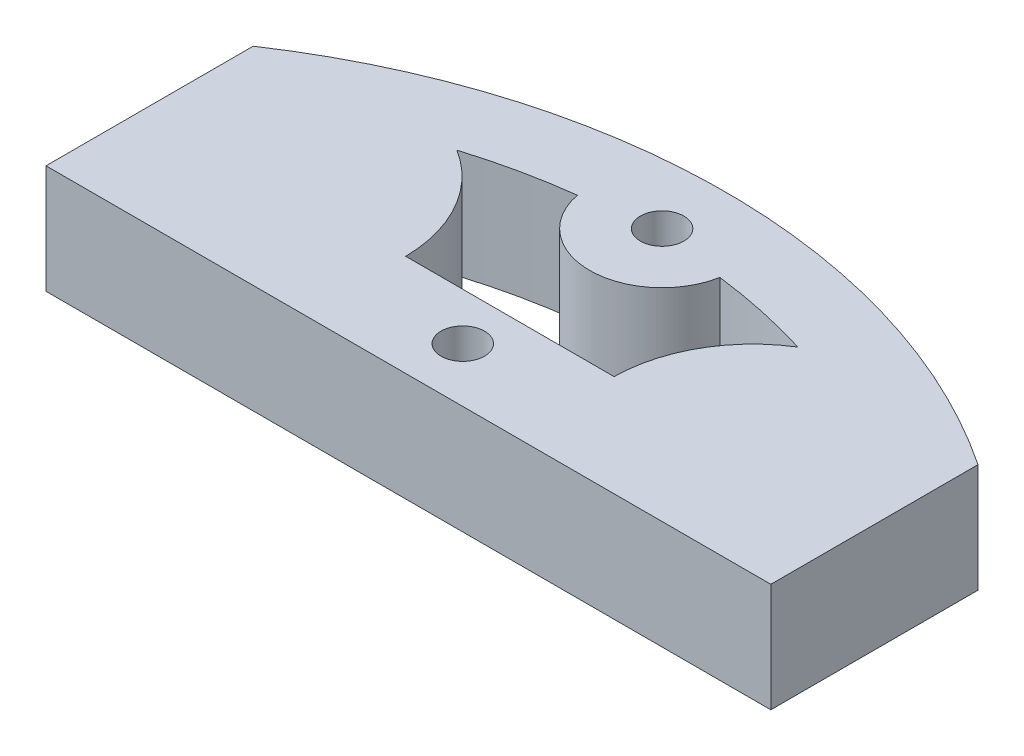
from build123d import *

# Parameters (mm, degrees)
BOSS_EXTRUDE1_DEPTH  = 6
CUT_EXTRUDE15_DEPTH  = 103.528044944
SKETCH19_OUTSIDE_W   = 185.536
SKETCH19_OUTSIDE_H   = 176.439
SKETCH19_OUTSIDE_W_2 = 80
SKETCH19_OUTSIDE_H_2 = 40
CUT_EXTRUDE16_DEPTH  = 103.528044944
SKETCH20_R           = 2.4
CUT_EXTRUDE17_DEPTH  = 84.234608187


with BuildPart() as part:
    # Sketch1 → Boss-Extrude1 (new, symmetric)
    with BuildSketch(Plane(origin=(0, 0, 0), x_dir=(1, 0, 0), z_dir=(0, 1, 0))):
        with BuildLine():
            ThreePointArc((36.224522061, -62.223661106), (0, 72), (-36.224522061, -62.223661106))
            ThreePointArc((-36.224522061, -62.223661106), (-32.797800029, -62.818856853), (-29.811944095, -61.035223988))
            ThreePointArc((-29.811944095, -61.035223988), (0, -46.75), (29.811944095, -61.035223988))
            ThreePointArc((29.811944095, -61.035223988), (32.797800029, -62.818856853), (36.224522061, -62.223661106))
        make_face()
    extrude(amount=BOSS_EXTRUDE1_DEPTH, both=True)

    # Sketch17 → Cut-Extrude15 (cut, through all)
    with BuildSketch(Plane(origin=(0, 6, 0), x_dir=(1, 0, 0), z_dir=(0, 1, 0))):
        with BuildLine():
            Line((11.501290376, 48.2), (-11.501290376, 48.2))
            ThreePointArc((-11.501290376, 48.2), (-13.503335986, 55.621683574), (-18.824890953, 61.168811339))
            ThreePointArc((-18.824890953, 61.168811339), (-13.394450398, 62.582654933), (-7.861037919, 63.515384615))
            ThreePointArc((-7.861037919, 63.515384615), (0, 57), (7.861037919, 63.515384615))
            ThreePointArc((7.861037919, 63.515384615), (13.394450398, 62.582654933), (18.824890953, 61.168811339))
            ThreePointArc((18.824890953, 61.168811339), (13.503335986, 55.621683574), (11.501290376, 48.2))
        make_face()
    extrude(amount=-CUT_EXTRUDE15_DEPTH, mode=Mode.SUBTRACT)

    # Sketch19 outside → Cut-Extrude16 (cut, through all)
    with BuildSketch(Plane(origin=(0, 6, 0), x_dir=(1, 0, 0), z_dir=(0, 1, 0))):
        with Locations((0, 4.5485)):
            Rectangle(SKETCH19_OUTSIDE_W, SKETCH19_OUTSIDE_H)
        with Locations((0, 57)):
            Rectangle(SKETCH19_OUTSIDE_W_2, SKETCH19_OUTSIDE_H_2, mode=Mode.SUBTRACT)
    extrude(amount=-CUT_EXTRUDE16_DEPTH, mode=Mode.SUBTRACT)

    # Sketch20 → Cut-Extrude17 (cut, through all)
    with BuildSketch(Plane(origin=(0, 6, 0), x_dir=(1, 0, 0), z_dir=(0, 1, 0))):
        with Locations(Location((0, 65, 0), (0, 0, 270))):
            Circle(SKETCH20_R)
        with Locations(Location((0, 43, 0), (0, 0, 270))):
            Circle(SKETCH20_R)
    extrude(amount=-CUT_EXTRUDE17_DEPTH, mode=Mode.SUBTRACT)


solid = part.part
